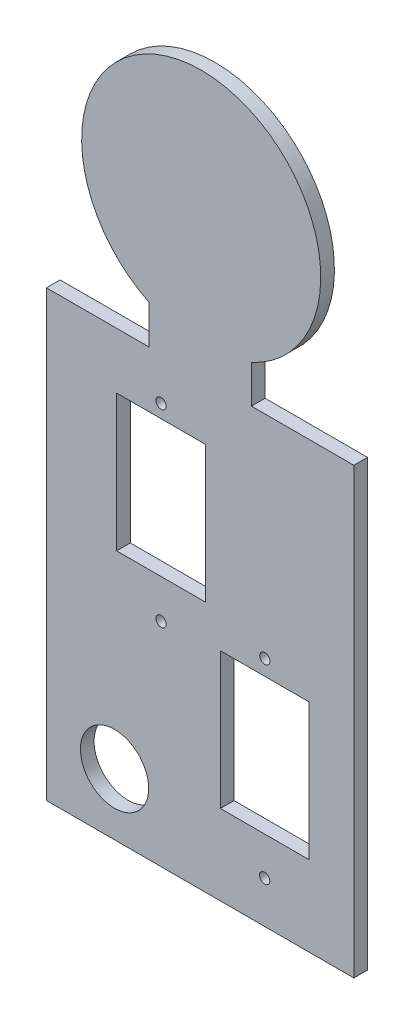
from build123d import *

# Parameters (mm, degrees)
BOSS_EXTRUDE1_DEPTH = 2
SKETCH3_W           = 13
SKETCH3_H           = 20
CUT_EXTRUDE1_DEPTH  = 11.5
SKETCH4_R           = 0.75
CUT_EXTRUDE2_DEPTH  = 4.5
SKETCH5_R           = 5
CUT_EXTRUDE3_DEPTH  = 10


with BuildPart() as part:
    # Sketch2 → Boss-Extrude1 (new body)
    with BuildSketch(Plane.XY):
        with BuildLine():
            Line((-7.651598568, -15.738584414), (-7.651598568, -21.41907999))
            Line((-7.651598568, -21.41907999), (-22.651598568, -21.41907999))
            Line((-22.651598568, -21.41907999), (-22.651598568, -86.41907999))
            Line((-22.651598568, -86.41907999), (22.348401432, -86.41907999))
            Line((22.348401432, -86.41907999), (22.348401432, -21.41907999))
            Line((22.348401432, -21.41907999), (7.348401432, -21.41907999))
            Line((7.348401432, -21.41907999), (7.348401432, -15.882411542))
            ThreePointArc((7.348401432, -15.882411542), (0.167790603, 17.49919559), (-7.651598568, -15.738584414))
        make_face()
    extrude(amount=BOSS_EXTRUDE1_DEPTH)

    # Sketch3 → Cut-Extrude1 (cut)
    with BuildSketch(Plane.XY.offset(2)):
        with Locations((9.306683573, -64.699747406)):
            Rectangle(SKETCH3_W, SKETCH3_H)
        with Locations((-5.874609334, -39.631347468)):
            Rectangle(SKETCH3_W, SKETCH3_H)
    extrude(amount=-CUT_EXTRUDE1_DEPTH, mode=Mode.SUBTRACT)

    # Sketch4 → Cut-Extrude2 (cut)
    with BuildSketch(Plane.XY.offset(2)):
        with Locations((-5.874609334, -27.679486822)):
            Circle(SKETCH4_R)
        with Locations((-5.874609334, -55.313369489)):
            Circle(SKETCH4_R)
        with Locations((9.318214062, -52.431887672)):
            Circle(SKETCH4_R)
        with Locations((9.290500092, -80.290661027)):
            Circle(SKETCH4_R)
    extrude(amount=-CUT_EXTRUDE2_DEPTH, mode=Mode.SUBTRACT)

    # Sketch5 → Cut-Extrude3 (cut)
    with BuildSketch(Plane.XY.offset(2)):
        with Locations((-12.686703833, -77.415205598)):
            Circle(SKETCH5_R)
    extrude(amount=-CUT_EXTRUDE3_DEPTH, mode=Mode.SUBTRACT)


solid = part.part
